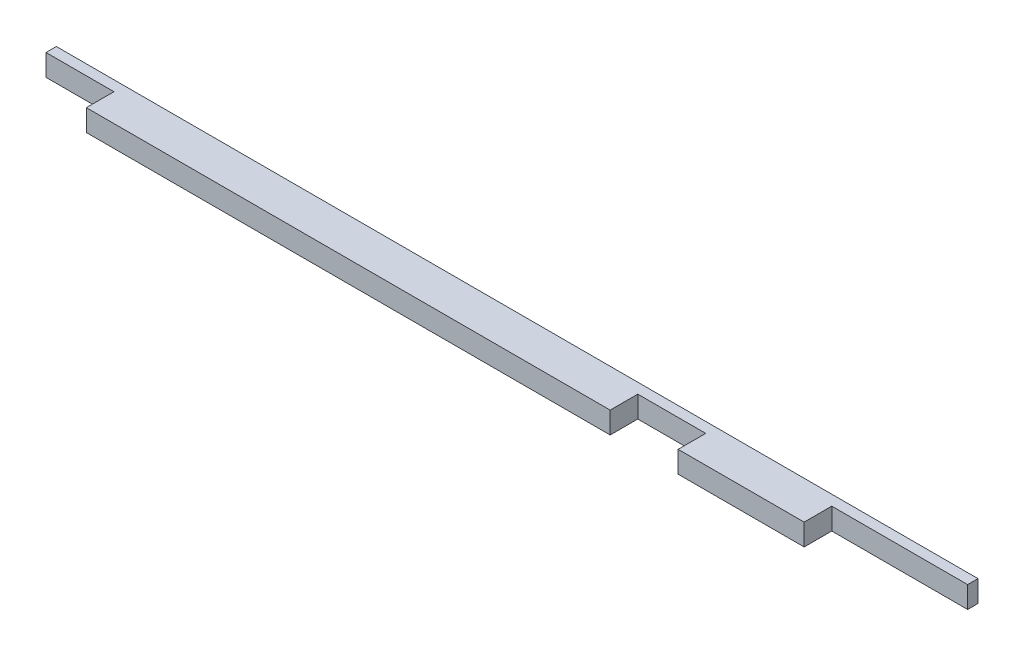
from build123d import *

# Parameters (mm, degrees)
BOSS_EXTRUDE1_DEPTH = 1.5875


with BuildPart() as part:
    # Sketch1 → Boss-Extrude1 (new body)
    with BuildSketch(Plane(origin=(0, 0, 0), x_dir=(1, 0, 0), z_dir=(0, 1, 0))):
        Polygon((5, 2.032), (5, 0), (38.55125958, 0), (43.55125958, 0), (43.55125958, 2.032), (48.55125958, 2.032), (48.55125958, 0), (57.82689, 0), (57.82689, 2.032), (67.82689, 2.032), (67.82689, 2.794), (0, 2.794), (0, 2.032), align=None)
    extrude(amount=BOSS_EXTRUDE1_DEPTH)


solid = part.part
